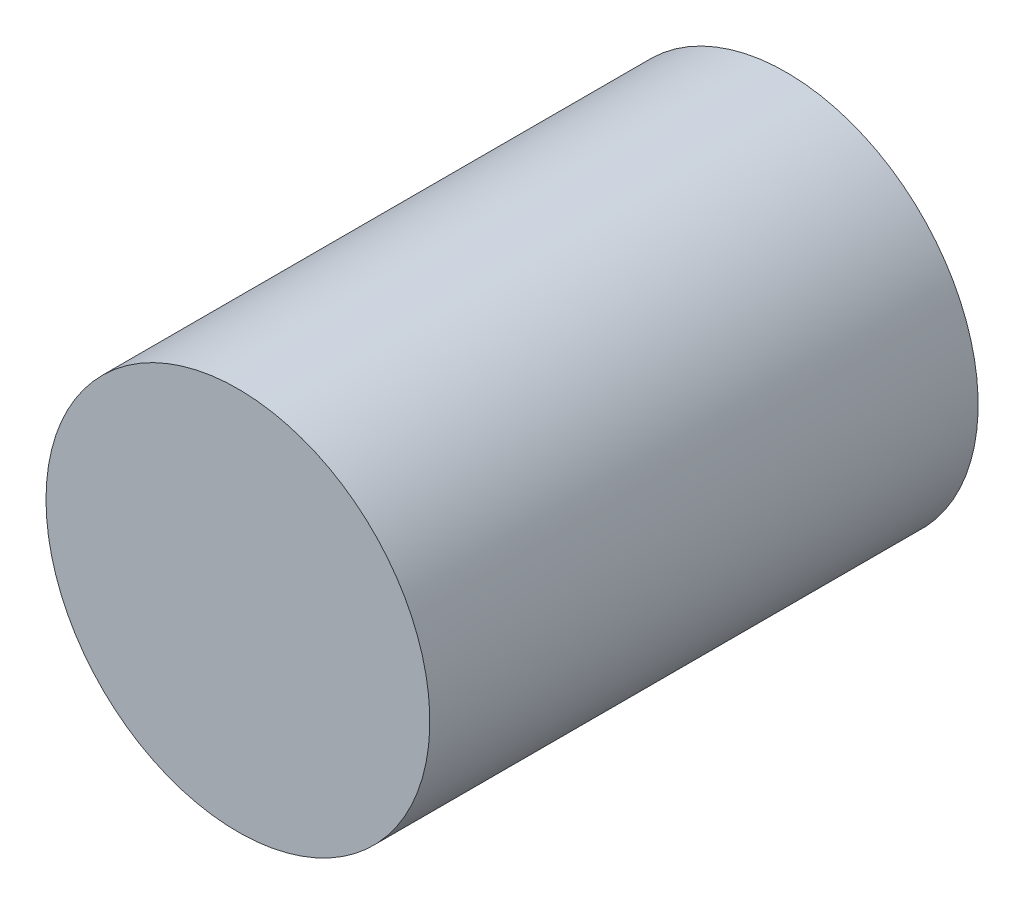
from build123d import *

# Parameters (mm, degrees)
SKETCH1_R           = 4.445
BOSS_EXTRUDE1_DEPTH = 12.7


with BuildPart() as part:
    # Sketch1 → Boss-Extrude1 (new body)
    with BuildSketch(Plane.XY):
        with Locations(Location((0, 0, 0), (0, 0, 180))):
            Circle(SKETCH1_R)
    extrude(amount=BOSS_EXTRUDE1_DEPTH)


solid = part.part
